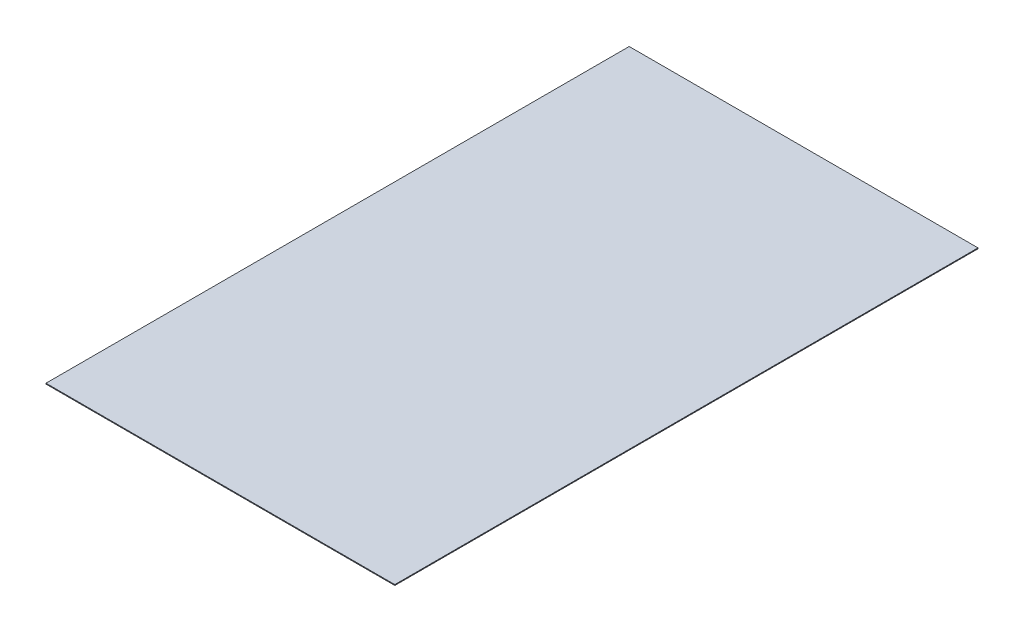
from build123d import *

# Parameters (mm, degrees)
SKETCH_2_W      = 1274
SKETCH_2_H      = 2130
EXTRUDE_1_DEPTH = 3


with BuildPart() as part:
    # Эскиз2 → Бобышка-Вытянуть1 (new body)
    with BuildSketch(Plane(origin=(0, 0, 0), x_dir=(1, 0, 0), z_dir=(0, 1, 0))):
        with Locations((637, 1065)):
            Rectangle(SKETCH_2_W, SKETCH_2_H)
    extrude(amount=EXTRUDE_1_DEPTH)


solid = part.part
